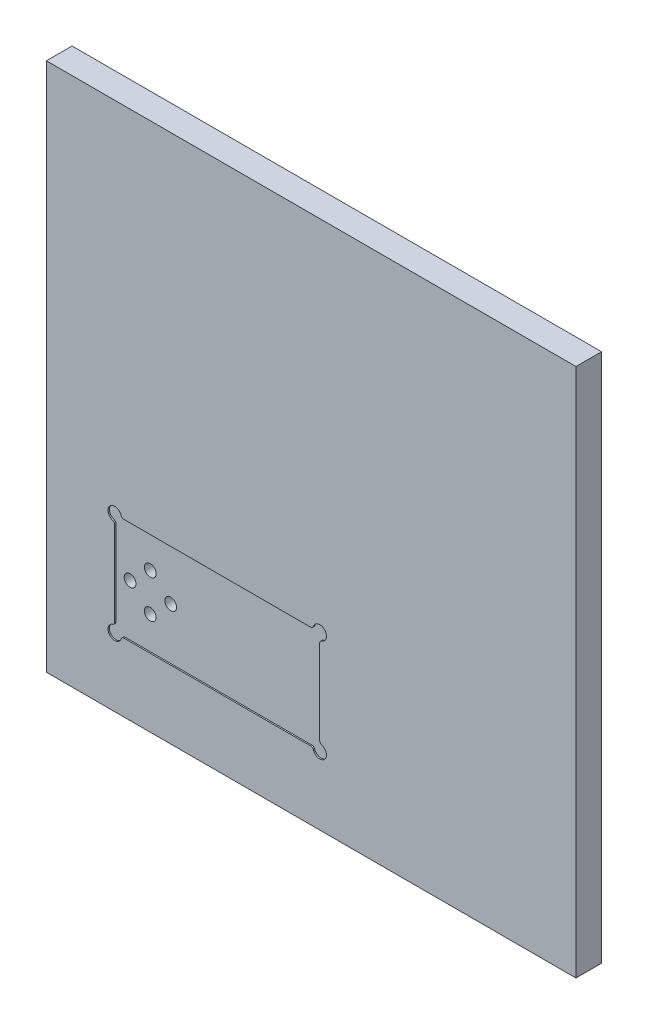
from build123d import *

# Parameters (mm, degrees)
SKETCH1_W           = 393.7
SKETCH1_H           = 393.7
BOSS_EXTRUDE1_DEPTH = 19.05
CUT_EXTRUDE2_DEPTH  = 1
SKETCH3_R           = 4.365625
CUT_EXTRUDE4_DEPTH  = 12.5
FILLET1_R           = 2


with BuildPart() as part:
    # Sketch1 → Boss-Extrude1 (new body)
    with BuildSketch(Plane.XY):
        with Locations((196.85, 196.85)):
            Rectangle(SKETCH1_W, SKETCH1_H)
    extrude(amount=BOSS_EXTRUDE1_DEPTH)

    # Sketch2 → Cut-Extrude2 (cut)
    with BuildSketch(Plane.XY.offset(19.05)):
        with BuildLine():
            Line((55.8, 50.8), (198.2, 50.8))
            ThreePointArc((198.2, 50.8), (206.735533906, 47.264466094), (203.2, 55.8))
            Line((203.2, 55.8), (203.2, 122.254))
            ThreePointArc((203.2, 122.254), (206.735533906, 130.789533906), (198.2, 127.254))
            Line((198.2, 127.254), (55.8, 127.254))
            ThreePointArc((55.8, 127.254), (47.264466094, 130.789533906), (50.8, 122.254))
            Line((50.8, 122.254), (50.8, 55.8))
            ThreePointArc((50.8, 55.8), (47.264466094, 47.264466094), (55.8, 50.8))
        make_face()
    extrude(amount=-CUT_EXTRUDE2_DEPTH, mode=Mode.SUBTRACT)

    # Sketch3 → Cut-Extrude4 (cut)
    with BuildSketch(Plane.XY.offset(18.05)):
        with Locations((61.2, 89.2)):
            Circle(SKETCH3_R)
        with Locations((91.4, 89.2)):
            Circle(SKETCH3_R)
        with Locations((76.2, 75)):
            Circle(SKETCH3_R)
        with Locations((76.2, 103.2)):
            Circle(SKETCH3_R)
    extrude(amount=-CUT_EXTRUDE4_DEPTH, mode=Mode.SUBTRACT)

    # Fillet1
    fillet1_edges = [part.edges().sort_by_distance(p)[0] for p in [
        (203.2, 55.8, 18.55),
        (198.2, 50.8, 18.55),
        (55.8, 50.8, 18.55),
        (50.8, 55.8, 18.55),
        (50.8, 122.254, 18.55),
        (55.8, 127.254, 18.55),
        (198.2, 127.254, 18.55),
        (203.2, 122.254, 18.55),
    ]]
    fillet(fillet1_edges, radius=FILLET1_R)


solid = part.part
